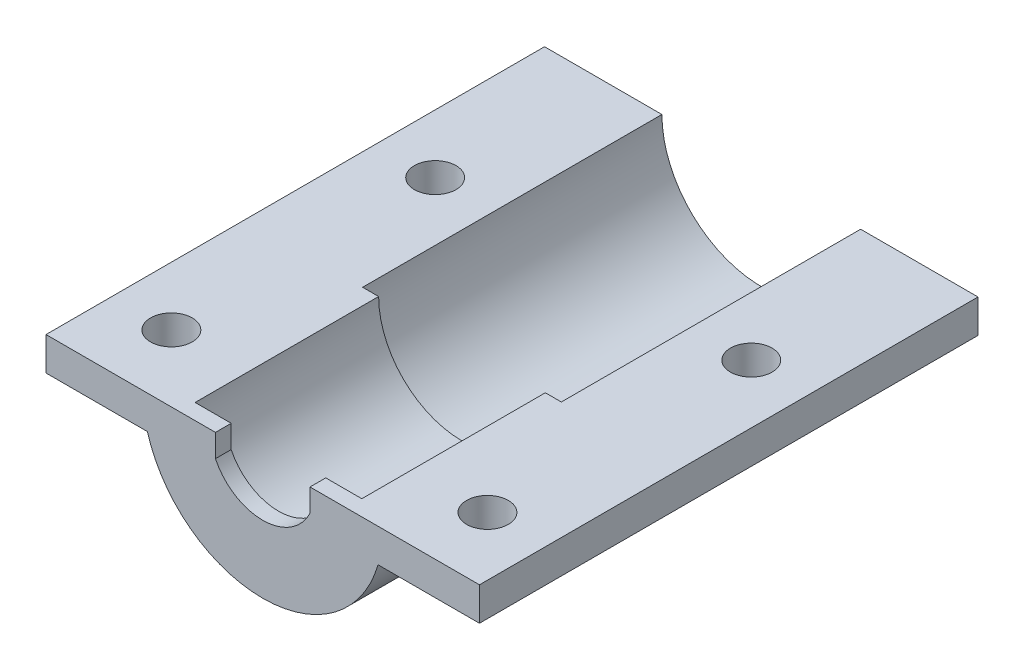
from build123d import *

# Parameters (mm, degrees)
BOSS_EXTRUDE1_DEPTH = 94.9452
SKETCH2_R           = 18.923
CUT_EXTRUDE1_DEPTH  = 56.9976
BOSS_EXTRUDE2_START = -2.9972
BOSS_EXTRUDE2_DEPTH = 2.9972
HOLE1_D             = 7.9375


with BuildPart() as part:
    # Sketch1 → Boss-Extrude1 (new body)
    with BuildSketch(Plane.XY):
        with BuildLine():
            Line((21.960352912, 16.51), (41.275, 16.51))
            Line((41.275, 16.51), (41.275, 22.86))
            Line((41.275, 22.86), (15.875, 22.86))
            ThreePointArc((15.875, 22.86), (0, 6.985), (-15.875, 22.86))
            Line((-15.875, 22.86), (-41.275, 22.86))
            Line((-41.275, 22.86), (-41.275, 16.51))
            Line((-41.275, 16.51), (-21.960352912, 16.51))
            ThreePointArc((-21.960352912, 16.51), (0, 0), (21.960352912, 16.51))
        make_face()
    extrude(amount=BOSS_EXTRUDE1_DEPTH)

    # Sketch2 → Cut-Extrude1 (cut)
    with BuildSketch(Plane(origin=(0, 0, 0), x_dir=(-1, 0, 0), z_dir=(0, 0, -1))):
        with Locations((0, 22.86)):
            Circle(SKETCH2_R)
    extrude(amount=-CUT_EXTRUDE1_DEPTH, mode=Mode.SUBTRACT)

    # Sketch3 → Boss-Extrude2 (add)
    with BuildSketch(Plane.XY.offset(94.9452).offset(BOSS_EXTRUDE2_START)):
        with BuildLine():
            Line((-15.875, 22.86), (-9.0043, 22.86))
            Line((-9.0043, 22.86), (-9.0043, 18.521727588))
            ThreePointArc((-9.0043, 18.521727588), (0, 12.8651), (9.0043, 18.521727588))
            Line((9.0043, 18.521727588), (9.0043, 22.86))
            Line((9.0043, 22.86), (15.875, 22.86))
            ThreePointArc((15.875, 22.86), (0, 6.985), (-15.875, 22.86))
        make_face()
    extrude(amount=BOSS_EXTRUDE2_DEPTH)

    # Hole1 (through all)
    with Locations(Plane(origin=(0, 16.51, 0), x_dir=(-1, 0, 0), z_dir=(0, -1, 0))):
        with Locations((30.099, -32.004), (30.099, -82.2452)):
            hole1 = Hole(HOLE1_D / 2)

    # Mirror1: Hole1 across plane
    add(hole1.mirror(Plane(origin=(0, 0, 0), x_dir=(0, 0, 1), z_dir=(1, 0, 0))), mode=Mode.SUBTRACT)


solid = part.part
